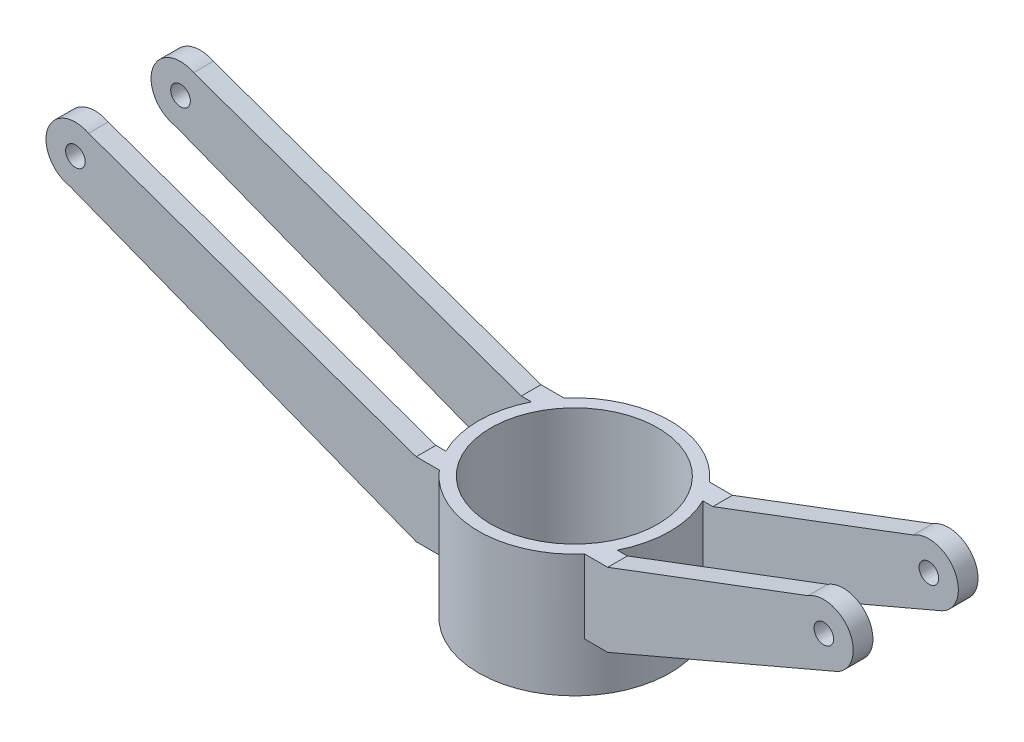
from build123d import *

# Parameters (mm, degrees)
SKETCH2_R             = 39
SKETCH2_R_2           = 34
BOSS_EXTRUDE1_DEPTH   = 50
SKETCH3_R             = 4
BOSS_EXTRUDE2_DEPTH   = 8
BOSS_EXTRUDE2_2_DEPTH = 8
SKETCH4_R             = 4
BOSS_EXTRUDE3_DEPTH   = 8
BOSS_EXTRUDE3_2_DEPTH = 8
BOSS_EXTRUDE4_START   = -30
BOSS_EXTRUDE4_DEPTH   = 30


with BuildPart() as part:
    # Sketch2 → Boss-Extrude1 (new body)
    with BuildSketch(Plane(origin=(0, 0, 0), x_dir=(1, 0, 0), z_dir=(0, 1, 0))):
        with Locations(Location((0, 0, 0), (0, 0, 270))):
            Circle(SKETCH2_R)
        with Locations(Location((0, 0, 0), (0, 0, 270))):
            Circle(SKETCH2_R_2, mode=Mode.SUBTRACT)
    extrude(amount=BOSS_EXTRUDE1_DEPTH)



with BuildPart() as body_2:
    # Sketch3 → Boss-Extrude2 (new body)
    with BuildSketch(Plane.XY.offset(25.4)):
        with BuildLine():
            Line((-39, 20), (-39, 50))
            Line((-39, 50), (-172.430922253, 97.352057933))
            ThreePointArc((-172.430922253, 97.352057933), (-189.169388202, 90.433792858), (-179.991273047, 74.819669887))
            Line((-179.991273047, 74.819669887), (-39, 20))
        make_face()
        with Locations((-177.792717004, 86.616548767)):
            Circle(SKETCH3_R, mode=Mode.SUBTRACT)
    extrude(amount=-BOSS_EXTRUDE2_DEPTH)


with BuildPart() as body_3:
    # Sketch3 → Boss-Extrude2 2 (new body)
    with BuildSketch(Plane.XY.offset(25.4)):
        with BuildLine():
            Line((39, 50), (39, 20))
            Line((39, 20), (130.917867667, 59.301005864))
            ThreePointArc((130.917867667, 59.301005864), (137.803128547, 75.857402278), (120.557867662, 80.768823316))
            Line((120.557867662, 80.768823316), (39, 50))
        make_face()
        with Locations((126.99576519, 70.641954332)):
            Circle(SKETCH3_R, mode=Mode.SUBTRACT)
    extrude(amount=-BOSS_EXTRUDE2_2_DEPTH)


with BuildPart() as body_4:
    # Sketch4 → Boss-Extrude3 (new body)
    with BuildSketch(Plane.XY.offset(-25.4)):
        with BuildLine():
            Line((39, 50), (120.557867662, 80.768823316))
            ThreePointArc((120.557867662, 80.768823316), (137.803128547, 75.857402278), (130.917867667, 59.301005864))
            Line((130.917867667, 59.301005864), (39, 20))
            Line((39, 20), (39, 50))
        make_face()
        with Locations((126.99576519, 70.641954332)):
            Circle(SKETCH4_R, mode=Mode.SUBTRACT)
    extrude(amount=BOSS_EXTRUDE3_DEPTH)


with BuildPart() as body_5:
    # Sketch4 → Boss-Extrude3 2 (new body)
    with BuildSketch(Plane.XY.offset(-25.4)):
        with BuildLine():
            Line((-172.430922253, 97.352057933), (-39, 50))
            Line((-39, 50), (-39, 20))
            Line((-39, 20), (-179.991273047, 74.819669887))
            ThreePointArc((-179.991273047, 74.819669887), (-189.169388202, 90.433792858), (-172.430922253, 97.352057933))
        make_face()
        with Locations((-177.792717004, 86.616548767)):
            Circle(SKETCH4_R, mode=Mode.SUBTRACT)
    extrude(amount=BOSS_EXTRUDE3_2_DEPTH)


with BuildPart() as part_1:
    add(part.part)

    add(body_2.part)  # Boss-Extrude4 merges body 2

    add(body_3.part)  # Boss-Extrude4 merges body 3

    add(body_4.part)  # Boss-Extrude4 merges body 4

    add(body_5.part)  # Boss-Extrude4 merges body 5
    # Sketch6 → Boss-Extrude4 (add)
    with BuildSketch(Plane(origin=(0, 50, 0), x_dir=(1, 0, 0), z_dir=(0, 1, 0)).offset(BOSS_EXTRUDE4_START)):
        with BuildLine():
            Line((39, 25.4), (39, 17.4))
            Line((39, 17.4), (34.903294973, 17.4))
            ThreePointArc((34.903294973, 17.4), (32.49606782, 21.563987948), (29.594594101, 25.4))
            Line((29.594594101, 25.4), (39, 25.4))
        make_face()
        with BuildLine():
            Line((39, -17.4), (39, -25.4))
            Line((39, -25.4), (29.594594101, -25.4))
            ThreePointArc((29.594594101, -25.4), (32.49606782, -21.563987948), (34.903294973, -17.4))
            Line((34.903294973, -17.4), (39, -17.4))
        make_face()
        with BuildLine():
            Line((-39, -25.4), (-39, -17.4))
            Line((-39, -17.4), (-34.903294973, -17.4))
            ThreePointArc((-34.903294973, -17.4), (-32.49606782, -21.563987948), (-29.594594101, -25.4))
            Line((-29.594594101, -25.4), (-39, -25.4))
        make_face()
        with BuildLine():
            Line((-39, 17.4), (-39, 25.4))
            Line((-39, 25.4), (-29.594594101, 25.4))
            ThreePointArc((-29.594594101, 25.4), (-32.49606782, 21.563987948), (-34.903294973, 17.4))
            Line((-34.903294973, 17.4), (-39, 17.4))
        make_face()
    extrude(amount=BOSS_EXTRUDE4_DEPTH)


solid = part_1.part
